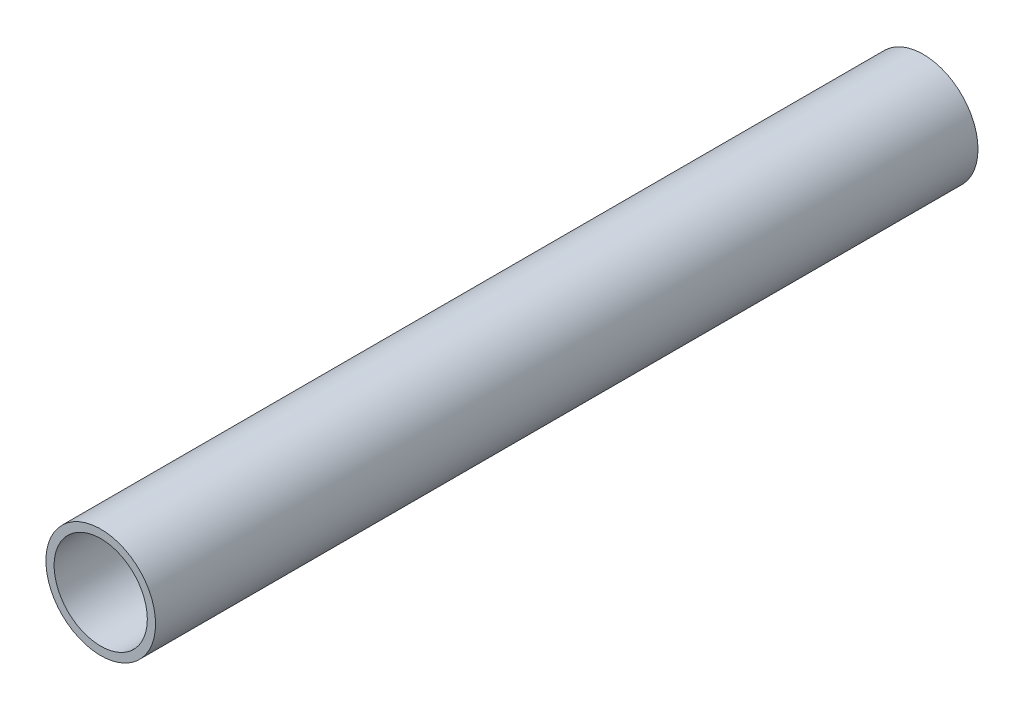
from build123d import *

# Parameters (mm, degrees)
SKETCH1_R           = 20
SKETCH1_R_2         = 17
BOSS_EXTRUDE1_DEPTH = 300


with BuildPart() as part:
    # Sketch1 → Boss-Extrude1 (new body)
    with BuildSketch(Plane.XY):
        Circle(SKETCH1_R)
        Circle(SKETCH1_R_2, mode=Mode.SUBTRACT)
    extrude(amount=BOSS_EXTRUDE1_DEPTH)


solid = part.part
